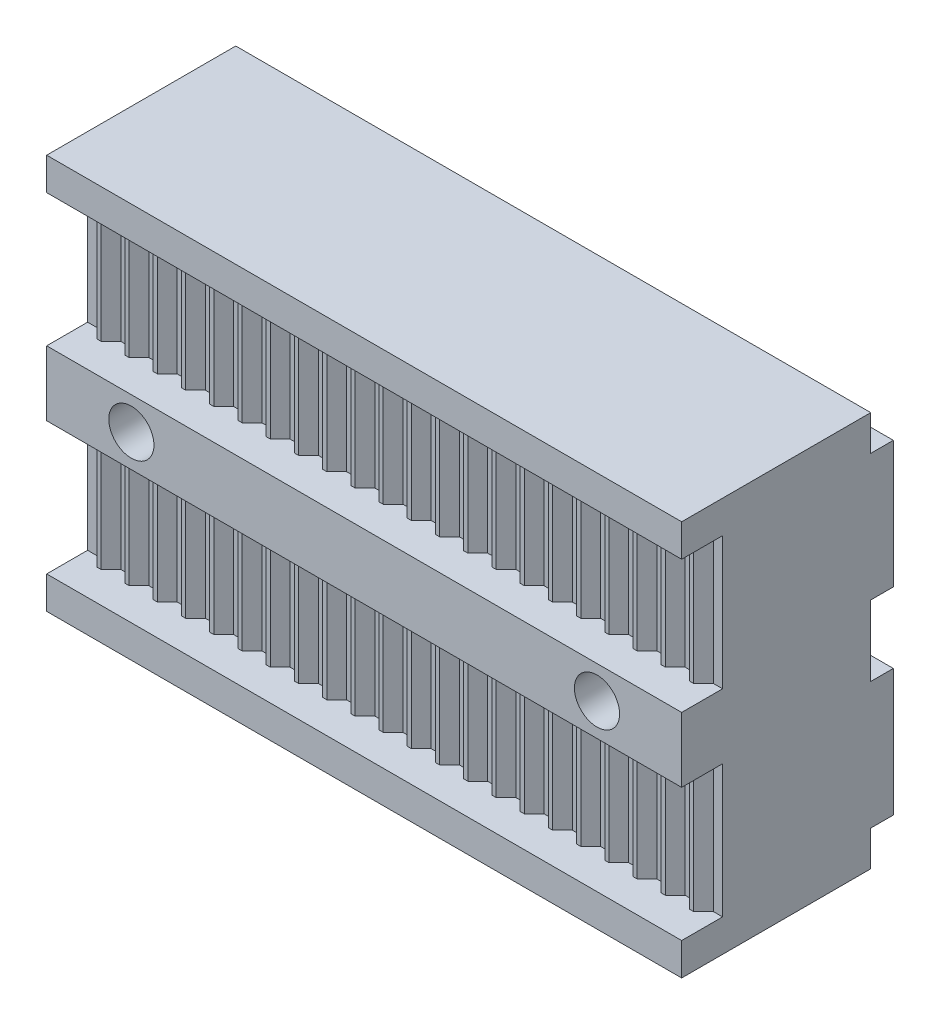
from build123d import *

# Parameters (mm, degrees)
SKETCH_1_W          = 45
SKETCH_1_H          = 28
EXTRUDE_1_DEPTH     = 13.4
EXTRUDE_START       = -2.5
SKETCH_2_W          = 45
SKETCH_2_H          = 1.6
EXTRUDE_2_DEPTH     = 9
EXTRUDE_START_2     = -16.5
SKETCH_2_2_W        = 45
SKETCH_2_2_H        = 1.6
EXTRUDE_3_DEPTH     = 9
SKETCH_3_W          = 45
SKETCH_3_H          = 9.4
CUT_EXTRUDE_1_DEPTH = 2.9
SKETCH_4_R          = 1.6
CUT_EXTRUDE_2_DEPTH = 56.081757416
EXTRUDE_4_DEPTH     = 9.4
EXTRUDE_START_3     = 14
EXTRUDE_5_DEPTH     = 9.4


with BuildPart() as part:
    # Эскиз1 → Бобышка-Вытянуть1 (new body)
    with BuildSketch(Plane.XY):
        with Locations((-22.5, -14)):
            Rectangle(SKETCH_1_W, SKETCH_1_H)
    extrude(amount=EXTRUDE_1_DEPTH)

    # Эскиз2 → Бобышка-Вытянуть2 (add)
    with BuildSketch(Plane(origin=(0, 0, 0), x_dir=(1, 0, 0), z_dir=(0, 1, 0)).offset(EXTRUDE_START)):
        with Locations((-22.5, 0.8)):
            Rectangle(SKETCH_2_W, SKETCH_2_H)
    extrude(amount=-EXTRUDE_2_DEPTH)

    # Эскиз2<2> → Бобышка-Вытянуть3 (add)
    with BuildSketch(Plane(origin=(0, 0, 0), x_dir=(1, 0, 0), z_dir=(0, 1, 0)).offset(EXTRUDE_START_2)):
        with Locations((-22.5, 0.8)):
            Rectangle(SKETCH_2_2_W, SKETCH_2_2_H)
    extrude(amount=-EXTRUDE_3_DEPTH)

    # Эскиз3 → Вырез-Вытянуть1 (cut)
    with BuildSketch(Plane.XY.offset(13.4)):
        with Locations((-22.5, -7)):
            Rectangle(SKETCH_3_W, SKETCH_3_H)
        with Locations((-22.5, -21)):
            Rectangle(SKETCH_3_W, SKETCH_3_H)
    extrude(amount=-CUT_EXTRUDE_1_DEPTH, mode=Mode.SUBTRACT)

    # Эскиз4 → Вырез-Вытянуть2 (cut, through all)
    with BuildSketch(Plane.XY.offset(13.4)):
        with Locations((-39, -14)):
            Circle(SKETCH_4_R)
        with Locations((-6, -14)):
            Circle(SKETCH_4_R)
    extrude(amount=-CUT_EXTRUDE_2_DEPTH, mode=Mode.SUBTRACT)

    # Эскиз5 → Бобышка-Вытянуть4 (add)
    with BuildSketch(Plane.XZ.offset(2.3)):
        Polygon((-45, 10.5), (-44.35, 10.5), (-43.65, 11.2), (-43.35, 11.2), (-42.65, 10.5), (-42.35, 10.5), (-41.65, 11.2), (-41.35, 11.2), (-40.65, 10.5), (-40.35, 10.5), (-39.65, 11.2), (-39.35, 11.2), (-38.65, 10.5), (-38.35, 10.5), (-37.65, 11.2), (-37.35, 11.2), (-36.65, 10.5), (-36.35, 10.5), (-35.65, 11.2), (-35.35, 11.2), (-34.65, 10.5), (-34.35, 10.5), (-33.65, 11.2), (-33.35, 11.2), (-32.65, 10.5), (-32.35, 10.5), (-31.65, 11.2), (-31.35, 11.2), (-30.65, 10.5), (-30.35, 10.5), (-29.65, 11.2), (-29.35, 11.2), (-28.65, 10.5), (-28.35, 10.5), (-27.65, 11.2), (-27.35, 11.2), (-26.65, 10.5), (-26.35, 10.5), (-25.65, 11.2), (-25.35, 11.2), (-24.65, 10.5), (-24.35, 10.5), (-23.65, 11.2), (-23.35, 11.2), (-22.65, 10.5), (-22.35, 10.5), (-21.65, 11.2), (-21.35, 11.2), (-20.65, 10.5), (-20.35, 10.5), (-19.65, 11.2), (-19.35, 11.2), (-18.65, 10.5), (-18.35, 10.5), (-17.65, 11.2), (-17.35, 11.2), (-16.65, 10.5), (-16.35, 10.5), (-15.65, 11.2), (-15.35, 11.2), (-14.65, 10.5), (-14.35, 10.5), (-13.65, 11.2), (-13.35, 11.2), (-12.65, 10.5), (-12.35, 10.5), (-11.65, 11.2), (-11.35, 11.2), (-10.65, 10.5), (-10.35, 10.5), (-9.65, 11.2), (-9.35, 11.2), (-8.65, 10.5), (-8.35, 10.5), (-7.65, 11.2), (-7.35, 11.2), (-6.65, 10.5), (-6.35, 10.5), (-5.65, 11.2), (-5.35, 11.2), (-4.65, 10.5), (-4.35, 10.5), (-3.65, 11.2), (-3.35, 11.2), (-2.65, 10.5), (-2.35, 10.5), (-1.65, 11.2), (-1.35, 11.2), (-0.65, 10.5), (0, 10.5), (0, 9.5), (-45, 9.5), align=None)
    extrude(amount=EXTRUDE_4_DEPTH)

    # Эскиз5<2> → Бобышка-Вытянуть5 (add)
    with BuildSketch(Plane.XZ.offset(2.3).offset(EXTRUDE_START_3)):
        Polygon((-45, 10.5), (-44.35, 10.5), (-43.65, 11.2), (-43.35, 11.2), (-42.65, 10.5), (-42.35, 10.5), (-41.65, 11.2), (-41.35, 11.2), (-40.65, 10.5), (-40.35, 10.5), (-39.65, 11.2), (-39.35, 11.2), (-38.65, 10.5), (-38.35, 10.5), (-37.65, 11.2), (-37.35, 11.2), (-36.65, 10.5), (-36.35, 10.5), (-35.65, 11.2), (-35.35, 11.2), (-34.65, 10.5), (-34.35, 10.5), (-33.65, 11.2), (-33.35, 11.2), (-32.65, 10.5), (-32.35, 10.5), (-31.65, 11.2), (-31.35, 11.2), (-30.65, 10.5), (-30.35, 10.5), (-29.65, 11.2), (-29.35, 11.2), (-28.65, 10.5), (-28.35, 10.5), (-27.65, 11.2), (-27.35, 11.2), (-26.65, 10.5), (-26.35, 10.5), (-25.65, 11.2), (-25.35, 11.2), (-24.65, 10.5), (-24.35, 10.5), (-23.65, 11.2), (-23.35, 11.2), (-22.65, 10.5), (-22.35, 10.5), (-21.65, 11.2), (-21.35, 11.2), (-20.65, 10.5), (-20.35, 10.5), (-19.65, 11.2), (-19.35, 11.2), (-18.65, 10.5), (-18.35, 10.5), (-17.65, 11.2), (-17.35, 11.2), (-16.65, 10.5), (-16.35, 10.5), (-15.65, 11.2), (-15.35, 11.2), (-14.65, 10.5), (-14.35, 10.5), (-13.65, 11.2), (-13.35, 11.2), (-12.65, 10.5), (-12.35, 10.5), (-11.65, 11.2), (-11.35, 11.2), (-10.65, 10.5), (-10.35, 10.5), (-9.65, 11.2), (-9.35, 11.2), (-8.65, 10.5), (-8.35, 10.5), (-7.65, 11.2), (-7.35, 11.2), (-6.65, 10.5), (-6.35, 10.5), (-5.65, 11.2), (-5.35, 11.2), (-4.65, 10.5), (-4.35, 10.5), (-3.65, 11.2), (-3.35, 11.2), (-2.65, 10.5), (-2.35, 10.5), (-1.65, 11.2), (-1.35, 11.2), (-0.65, 10.5), (0, 10.5), (0, 9.5), (-45, 9.5), align=None)
    extrude(amount=EXTRUDE_5_DEPTH)


solid = part.part
